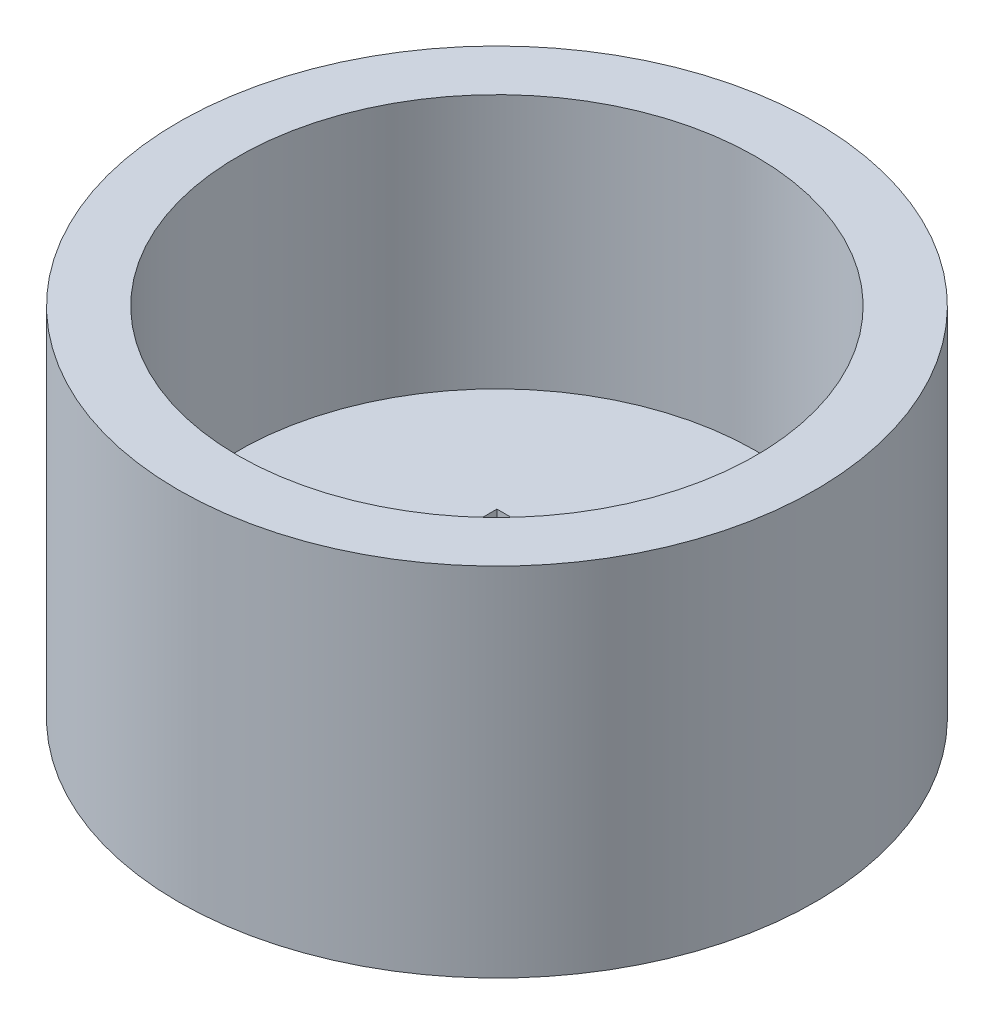
from build123d import *

# Parameters (mm, degrees)
SKETCH1_R           = 25
SKETCH1_R_2         = 20.325
BOSS_EXTRUDE1_DEPTH = 20
BOSS_EXTRUDE2_START = -8
SKETCH1_2_R         = 25
BOSS_EXTRUDE2_DEPTH = 8
SKETCH3_W           = 12.4
SKETCH3_H           = 4.8
SKETCH3_R           = 1.325
CUT_EXTRUDE1_DEPTH  = 2.7
SKETCH3_4_W         = 12.4
SKETCH3_4_H         = 22.5
CUT_EXTRUDE3_DEPTH  = 44.7
SKETCH3_5_R         = 1.325
CUT_EXTRUDE4_DEPTH  = 38.7


with BuildPart() as part:
    # Sketch1 → Boss-Extrude1 (new body)
    with BuildSketch(Plane(origin=(0, 0, 0), x_dir=(1, 0, 0), z_dir=(0, 1, 0))):
        Circle(SKETCH1_R)
        Circle(SKETCH1_R_2, mode=Mode.SUBTRACT)
    extrude(amount=BOSS_EXTRUDE1_DEPTH)

    # Sketch1<2> → Boss-Extrude2 (add)
    with BuildSketch(Plane(origin=(0, 0, 0), x_dir=(1, 0, 0), z_dir=(0, 1, 0)).offset(BOSS_EXTRUDE2_START)):
        Circle(SKETCH1_2_R)
    extrude(amount=BOSS_EXTRUDE2_DEPTH)

    # Sketch3 → Cut-Extrude1 (cut)
    # profile 1 of 2: a face of its own
    with BuildSketch(Plane.XZ.offset(8)):
        with Locations((0, -8.6)):
            Rectangle(SKETCH3_W, SKETCH3_H)
        with Locations((0, -8.6)):
            Circle(SKETCH3_R, mode=Mode.SUBTRACT)
    # profile 2 of 2: a face of its own
    with BuildSketch(Plane.XZ.offset(8)):
        with Locations((0, 18.7)):
            Rectangle(SKETCH3_W, SKETCH3_H)
        with Locations((0, 18.7)):
            Circle(SKETCH3_R, mode=Mode.SUBTRACT)
    extrude(amount=-CUT_EXTRUDE1_DEPTH, mode=Mode.SUBTRACT)

    # Sketch3<4> → Cut-Extrude3 (cut)
    with BuildSketch(Plane.XZ.offset(8)):
        with Locations((0, 5.05)):
            Rectangle(SKETCH3_4_W, SKETCH3_4_H)
    extrude(amount=-CUT_EXTRUDE3_DEPTH, mode=Mode.SUBTRACT)

    # Sketch3<5> → Cut-Extrude4 (cut)
    with BuildSketch(Plane.XZ.offset(8)):
        with Locations((0, -8.6)):
            Circle(SKETCH3_5_R)
        with Locations((0, 18.7)):
            Circle(SKETCH3_5_R)
    extrude(amount=-CUT_EXTRUDE4_DEPTH, mode=Mode.SUBTRACT)


solid = part.part
